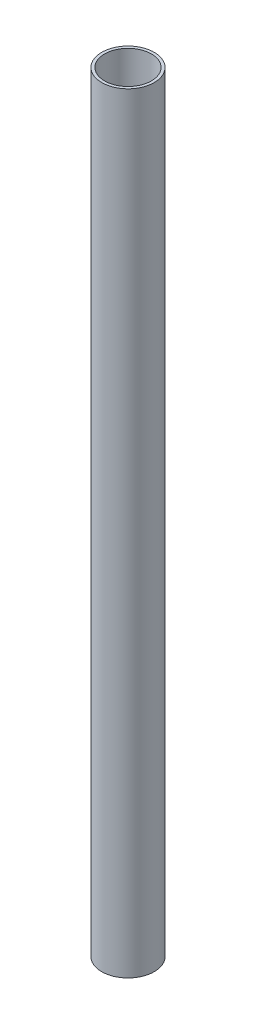
from build123d import *

# Parameters (mm, degrees)
SKETCH1_R           = 37.465
SKETCH1_R_2         = 33.465008
BOSS_EXTRUDE1_DEPTH = 1099.999999894


with BuildPart() as part:
    # Sketch1 → Boss-Extrude1 (new body)
    with BuildSketch(Plane(origin=(0, 0, 0), x_dir=(1, 0, 0), z_dir=(0, 1, 0))):
        with Locations(Location((0, 0, 0), (0, 0, 270))):
            Circle(SKETCH1_R)
        with Locations(Location((0, 0, 0), (0, 0, 270))):
            Circle(SKETCH1_R_2, mode=Mode.SUBTRACT)
    extrude(amount=BOSS_EXTRUDE1_DEPTH)


solid = part.part
